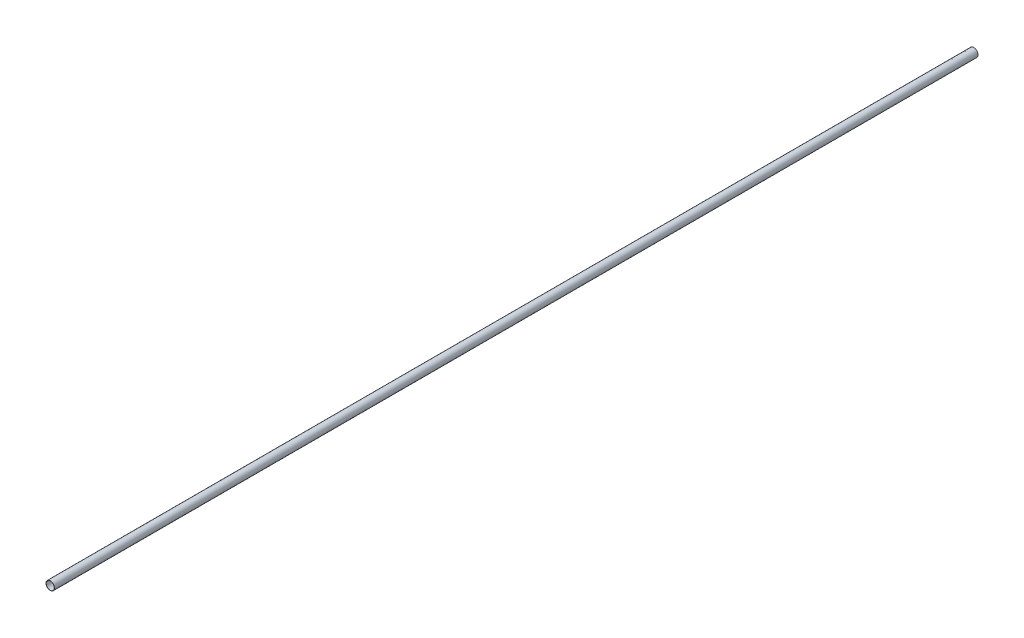
from build123d import *

# Parameters (mm, degrees)
SKETCH1_R        = 55
SKETCH1_R_2      = 52.7
EXTRUSION1_DEPTH = 12000


with BuildPart() as part:
    # Sketch1 → Extrusion1 (new body)
    with BuildSketch(Plane.XY):
        with Locations((0.140137906, 0)):
            Circle(SKETCH1_R)
        with Locations((0.140137906, 0)):
            Circle(SKETCH1_R_2, mode=Mode.SUBTRACT)
    extrude(amount=EXTRUSION1_DEPTH)


solid = part.part
